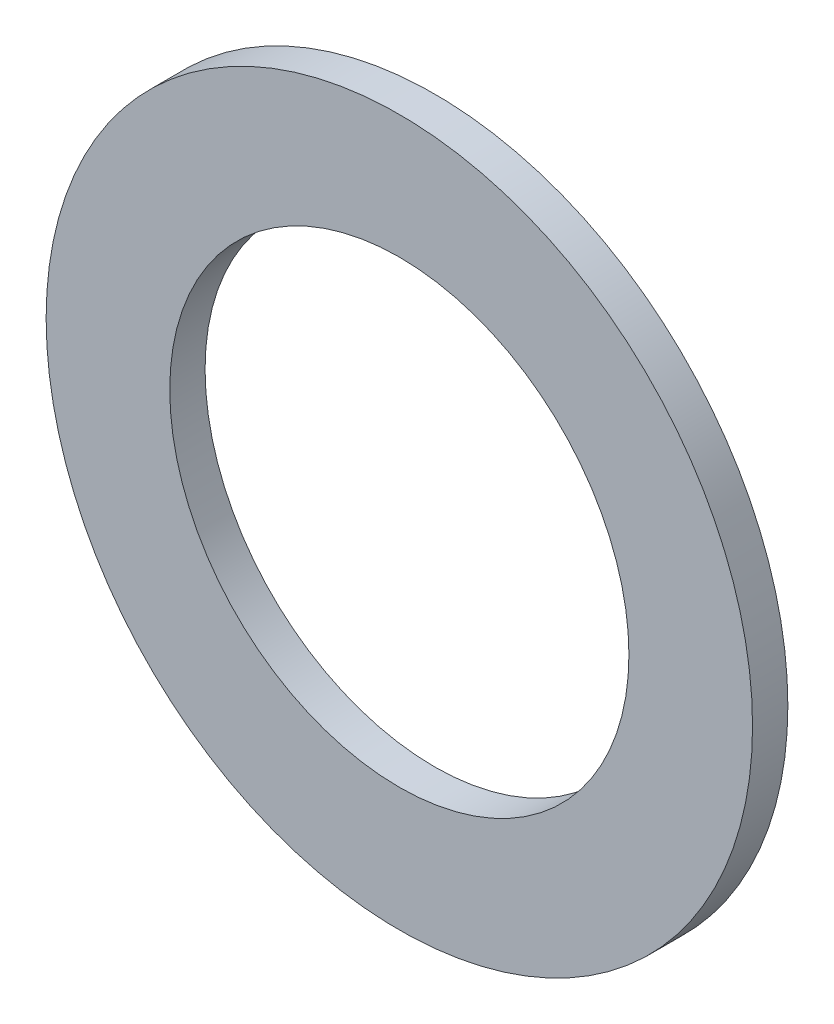
from build123d import *

# Parameters (mm, degrees)
SKETCH_1_R      = 5
SKETCH_1_R_2    = 3.25
EXTRUDE_1_DEPTH = 0.5


with BuildPart() as part:
    # Эскиз1 → Вытянуть1 (new body)
    with BuildSketch(Plane.XY):
        Circle(SKETCH_1_R)
        Circle(SKETCH_1_R_2, mode=Mode.SUBTRACT)
    extrude(amount=EXTRUDE_1_DEPTH)


solid = part.part
